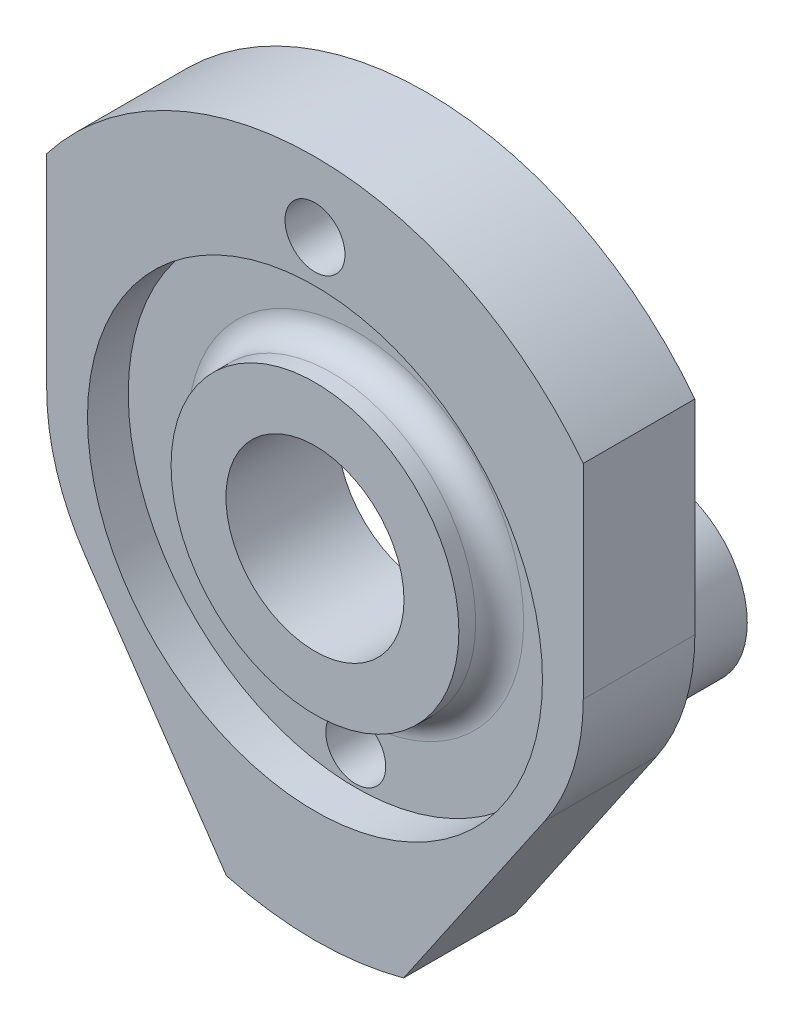
from build123d import *

# Parameters (mm, degrees)
SKETCH1_R           = 5
SKETCH1_R_2         = 14.85
BOSS_EXTRUDE1_DEPTH = 18.61
SKETCH3_R           = 37.94
SKETCH3_R_2         = 24
CUT_EXTRUDE1_DEPTH  = 6.8
SKETCH4_R           = 14.35
BOSS_EXTRUDE2_DEPTH = 50.95
SKETCH5_R           = 5
CUT_EXTRUDE2_DEPTH  = 27.24
FILLET1_R           = 4


with BuildPart() as part:
    # Sketch1 → Boss-Extrude1 (new body)
    with BuildSketch(Plane.XY):
        with BuildLine():
            Line((44.744350737, 34.662704412), (44.744350737, 0.617322885))
            ThreePointArc((44.744350737, 0.617322885), (43.097385261, -10.288147364), (38.303391852, -20.220891388))
            Line((38.303391852, -20.220891388), (14.7812281, -54.635842593))
            ThreePointArc((14.7812281, -54.635842593), (0, -56.6), (-14.7812281, -54.635842593))
            Line((-14.7812281, -54.635842593), (-38.299041115, -20.22725689))
            ThreePointArc((-38.299041115, -20.22725689), (-43.093034524, -10.294512867), (-44.74, 0.610957382))
            Line((-44.74, 0.610957382), (-44.74, 34.668319832))
            ThreePointArc((-44.74, 34.668319832), (0.003551826, 56.599999889), (44.744350737, 34.662704412))
        make_face()
        with Locations((0, 44.95)):
            Circle(SKETCH1_R, mode=Mode.SUBTRACT)
        Circle(SKETCH1_R_2, mode=Mode.SUBTRACT)
    extrude(amount=-BOSS_EXTRUDE1_DEPTH)

    # Sketch3 → Cut-Extrude1 (cut)
    with BuildSketch(Plane.XY):
        Circle(SKETCH3_R)
        Circle(SKETCH3_R_2, mode=Mode.SUBTRACT)
    extrude(amount=-CUT_EXTRUDE1_DEPTH, mode=Mode.SUBTRACT)

    # Sketch4 → Boss-Extrude2 (add)
    with BuildSketch(Plane.XY.offset(-6.8)):
        with Locations((0, -32.4)):
            Circle(SKETCH4_R)
    extrude(amount=-BOSS_EXTRUDE2_DEPTH)

    # Sketch5 → Cut-Extrude2 (cut)
    with BuildSketch(Plane.XY.offset(-6.8)):
        with Locations((0, -32.4)):
            Circle(SKETCH5_R)
    extrude(amount=-CUT_EXTRUDE2_DEPTH, mode=Mode.SUBTRACT)

    # Fillet1
    fillet1_edges = [part.edges().sort_by_distance(p)[0] for p in [
        (-24, 0, -6.8),
    ]]
    fillet(fillet1_edges, radius=FILLET1_R)


solid = part.part
